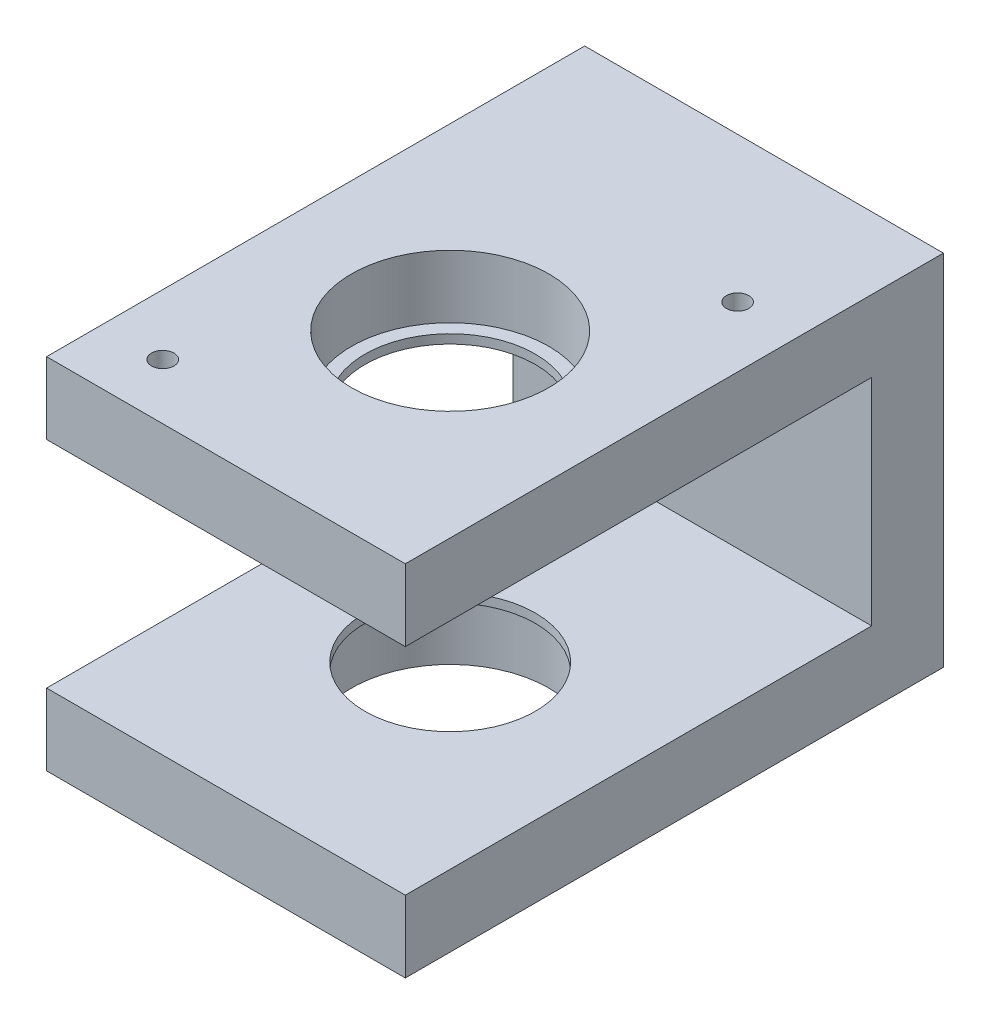
from build123d import *

# Parameters (mm, degrees)
SKETCH1_W                      = 40
SKETCH1_H                      = 60
BOSS_EXTRUDE1_DEPTH            = 40
SKETCH2_W                      = 52
SKETCH2_H                      = 24
CUT_EXTRUDE1_DEPTH             = 83.462112512
F_4_5_4_5_DIAMETER_HOLE1_D     = 4.5
F_22_0_22_DIAMETER_HOLE2_D     = 22
F_22_0_22_DIAMETER_HOLE2_DEPTH = 7
F_22_0_22_DIAMETER_HOLE1_D     = 22
F_22_0_22_DIAMETER_HOLE1_DEPTH = 7
F_2_5_2_5_DIAMETER_HOLE1_D     = 2.5
F_2_5_2_5_DIAMETER_HOLE1_DEPTH = 8
F_2_5_2_5_DIAMETER_HOLE1_TIP   = 0.721687836
CHAMFER1_SIZE                  = 2
F_19_0_19_DIAMETER_HOLE1_D     = 19
F_2MM_PIN_REACH                = 78.837
SKETCH13_R                     = 1


with BuildPart() as part:
    # Sketch1 → Boss-Extrude1 (new body)
    with BuildSketch(Plane(origin=(0, 40, 0), x_dir=(1, 0, 0), z_dir=(0, 1, 0))):
        with Locations((20, -30)):
            Rectangle(SKETCH1_W, SKETCH1_H)
    extrude(amount=-BOSS_EXTRUDE1_DEPTH)

    # Sketch2 → Cut-Extrude1 (cut, through all)
    with BuildSketch(Plane(origin=(40, 0, 0), x_dir=(0, 0, -1), z_dir=(1, 0, 0))):
        with Locations((-34, 20)):
            Rectangle(SKETCH2_W, SKETCH2_H)
    extrude(amount=-CUT_EXTRUDE1_DEPTH, mode=Mode.SUBTRACT)

    # Ø4.5 (4.5) Diameter Hole1 (through all)
    with Locations(Plane.XY.offset(8)):
        with Locations((20, 20)):
            Hole(F_4_5_4_5_DIAMETER_HOLE1_D / 2)

    # Ø22.0 (22) Diameter Hole2
    with Locations(Plane(origin=(0, 40, 0), x_dir=(-1, 0, 0), z_dir=(0, 1, 0))):
        with Locations((-20, 35)):
            Hole(F_22_0_22_DIAMETER_HOLE2_D / 2, depth=F_22_0_22_DIAMETER_HOLE2_DEPTH)

    # Ø22.0 (22) Diameter Hole1
    with Locations(Plane.XZ):
        with Locations((20, 35)):
            Hole(F_22_0_22_DIAMETER_HOLE1_D / 2, depth=F_22_0_22_DIAMETER_HOLE1_DEPTH)

    # Ø2.5 (2.5) Diameter Hole1
    with Locations(Plane(origin=(0, 40, 0), x_dir=(1, 0, 0), z_dir=(0, 1, 0))):
        with Locations((33.24990566, -16.2), (6.75009434, -53.8)):
            Hole(F_2_5_2_5_DIAMETER_HOLE1_D / 2, depth=F_2_5_2_5_DIAMETER_HOLE1_DEPTH)
            with Locations((0, 0, -(F_2_5_2_5_DIAMETER_HOLE1_DEPTH + F_2_5_2_5_DIAMETER_HOLE1_TIP / 2))):  # 120° drill point
                Cone(0, F_2_5_2_5_DIAMETER_HOLE1_D / 2, F_2_5_2_5_DIAMETER_HOLE1_TIP, mode=Mode.SUBTRACT)

    # Chamfer1
    chamfer1_edges = [part.edges().sort_by_distance(p)[0] for p in [
        (22.25, 20, 8),
    ]]
    chamfer(chamfer1_edges, length=CHAMFER1_SIZE)

    # Ø19.0 (19) Diameter Hole1 (through all)
    with Locations(Plane(origin=(0, 7, 0), x_dir=(-1, 0, 0), z_dir=(0, -1, 0))):
        with Locations((-20, -35)):
            Hole(F_19_0_19_DIAMETER_HOLE1_D / 2)

    # Sketch13 → 2mm Pin (cut, up to next)
    with BuildSketch(Plane.XY.offset(8), mode=Mode.PRIVATE) as f_2mm_pin_sk1:
        with Locations((10, 20)):
            Circle(SKETCH13_R)
    f_2mm_pin_tool1 = extrude(f_2mm_pin_sk1.sketch, amount=-F_2MM_PIN_REACH, mode=Mode.PRIVATE) & part.part
    add(f_2mm_pin_tool1.solids().sort_by_distance((10, 20, 8))[0], mode=Mode.SUBTRACT)


solid = part.part
